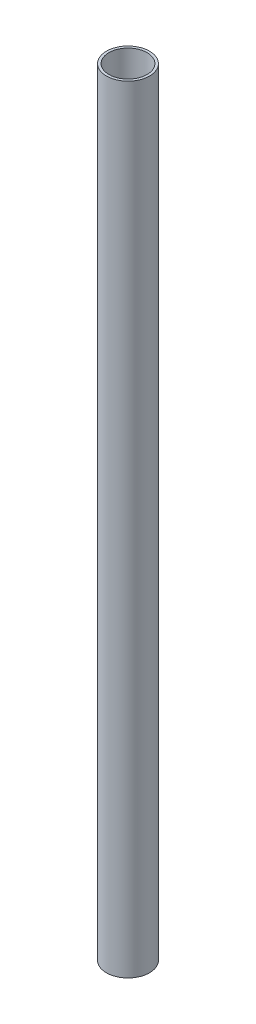
from build123d import *

# Parameters (mm, degrees)
BOSS_EXTRUDE1_DEPTH      = 114.439922
BOSS_EXTRUDE1_DEPTH_BACK = 114.439922
SKETCH1_R                = 6.35
SKETCH1_R_2              = 5.6134


with BuildPart() as part:
    # Sketch1 → Boss-Extrude1 (new, two sides: drawn at the far end of the back side and taken through both)
    with BuildSketch(Plane(origin=(163.047462272, 166.552044149, 0), x_dir=(1, 0, 0), z_dir=(0, 1, 0)).offset(-BOSS_EXTRUDE1_DEPTH_BACK)):
        with Locations(Location((0, 0, 0), (0, 0, 180))):
            Circle(SKETCH1_R)
        with Locations(Location((0, 0, 0), (0, 0, 180))):
            Circle(SKETCH1_R_2, mode=Mode.SUBTRACT)
    extrude(amount=BOSS_EXTRUDE1_DEPTH + BOSS_EXTRUDE1_DEPTH_BACK)


solid = part.part
